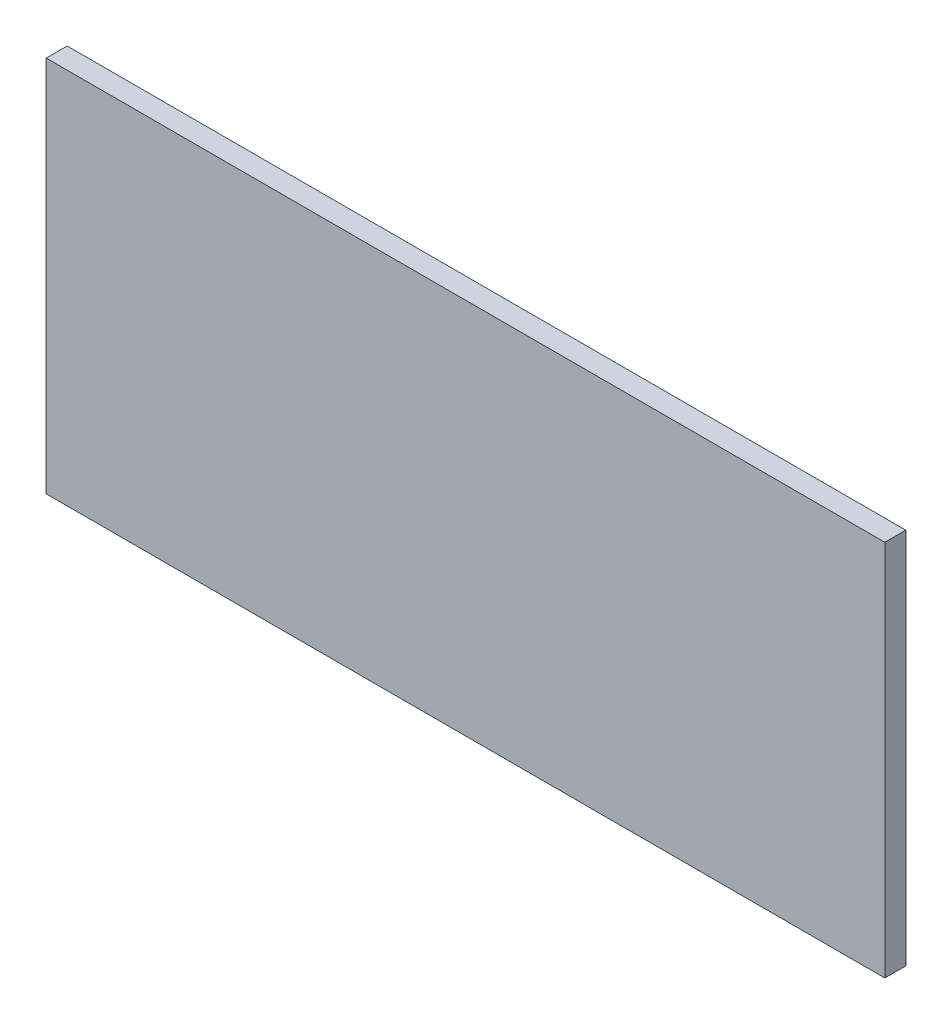
from build123d import *

# Parameters (mm, degrees)
ESQUISSE1_W        = 400
ESQUISSE1_H        = 180
BOSS_EXTRU_1_DEPTH = 10


with BuildPart() as part:
    # Esquisse1 → Boss.-Extru.1 (new body)
    with BuildSketch(Plane.XY):
        with Locations((-200, 90)):
            Rectangle(ESQUISSE1_W, ESQUISSE1_H)
    extrude(amount=BOSS_EXTRU_1_DEPTH)


solid = part.part
